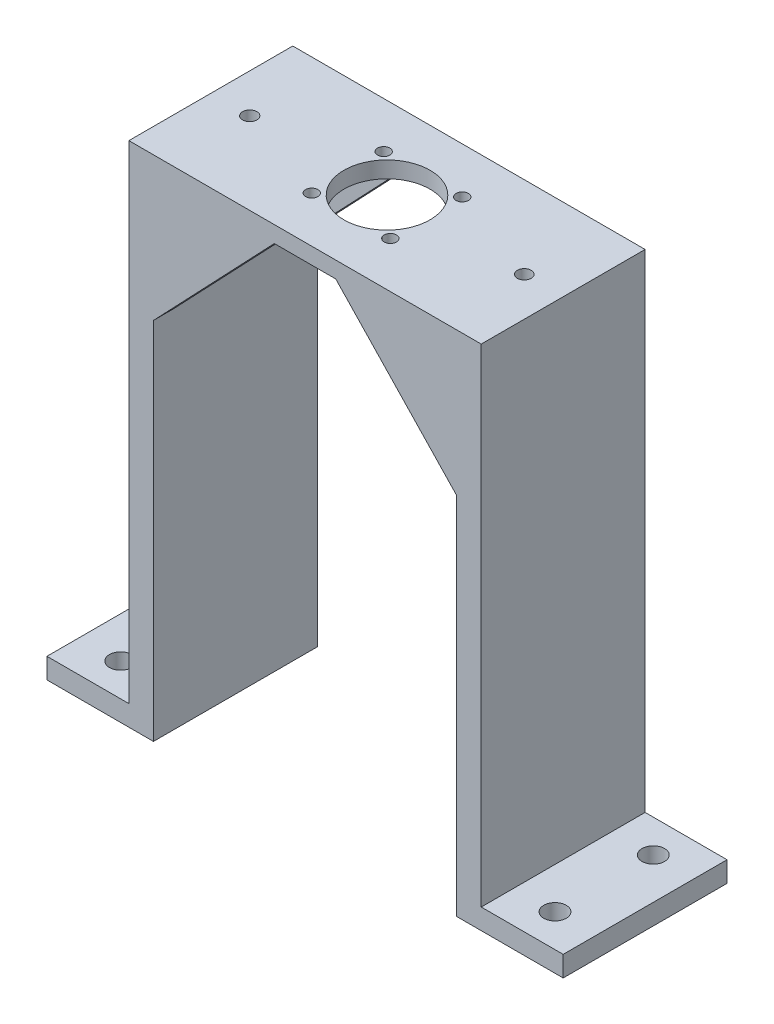
from build123d import *

# Parameters (mm, degrees)
ESQUISSE1_W              = 86
ESQUISSE1_H              = 40
BOSS_EXTRU_1_DEPTH       = 4
ESQUISSE2_R              = 10.5
ENL_V_MAT_EXTRU_1_DEPTH  = 95.93155429
ESQUISSE3_W              = 6
ESQUISSE3_H              = 40
BOSS_EXTRU_2_DEPTH       = 120
ESQUISSE4_W              = 40
ESQUISSE4_H              = 5
BOSS_EXTRU_3_DEPTH       = 20
ESQUISSE5_W              = 40
ESQUISSE5_H              = 5
BOSS_EXTRU_4_DEPTH       = 20
D_GAGEMENT_M51_D         = 5.5
ESQUISSE32_W             = 40
ESQUISSE32_H             = 31
BOSS_EXTRU_5_DEPTH       = 29.5
ESQUISSE33_W             = 40
ESQUISSE33_H             = 31
BOSS_EXTRU_6_DEPTH       = 29.5
ESQUISSE39_R             = 1.5
ENL_V_MAT_EXTRU_4_DEPTH  = 168.964281917
ESQUISSE43_W             = 30
ESQUISSE43_H             = 31
ENL_V_MAT_EXTRU_12_DEPTH = 29.5
ESQUISSE44_W             = 30
ESQUISSE44_H             = 31
ENL_V_MAT_EXTRU_13_DEPTH = 29.5
ENL_V_MAT_EXTRU_14_DEPTH = 166.033329967
ESQUISSE47_R             = 1.75
ESQUISSE47_R_2           = 1.7
ENL_V_MAT_EXTRU_15_DEPTH = 168.964281917


with BuildPart() as part:
    # Esquisse1 → Boss.-Extru.1 (new body)
    with BuildSketch(Plane(origin=(0, 0, 0), x_dir=(1, 0, 0), z_dir=(0, 1, 0))):
        with Locations((43, 20)):
            Rectangle(ESQUISSE1_W, ESQUISSE1_H)
    extrude(amount=BOSS_EXTRU_1_DEPTH)

    # Esquisse2 → Enlèv. mat.-Extru.1 (cut, through all)
    with BuildSketch(Plane(origin=(0, 4, 0), x_dir=(1, 0, 0), z_dir=(0, 1, 0))):
        with Locations(Location((43, 20, 0), (0, 0, 270))):
            Circle(ESQUISSE2_R)
    extrude(amount=-ENL_V_MAT_EXTRU_1_DEPTH, mode=Mode.SUBTRACT)

    # Esquisse3 → Boss.-Extru.2 (add)
    with BuildSketch(Plane(origin=(0, 0, 0), x_dir=(-1, 0, 0), z_dir=(0, -1, 0))):
        with Locations((-3, 20)):
            Rectangle(ESQUISSE3_W, ESQUISSE3_H)
        with Locations((-83, 20)):
            Rectangle(ESQUISSE3_W, ESQUISSE3_H)
    extrude(amount=BOSS_EXTRU_2_DEPTH)

    # Esquisse4 → Boss.-Extru.3 (add)
    with BuildSketch(Plane.ZY):
        with Locations((-20, -117.5)):
            Rectangle(ESQUISSE4_W, ESQUISSE4_H)
    extrude(amount=BOSS_EXTRU_3_DEPTH)

    # Esquisse5 → Boss.-Extru.4 (add)
    with BuildSketch(Plane(origin=(86, 0, 0), x_dir=(0, 0, -1), z_dir=(1, 0, 0))):
        with Locations((20, -117.5)):
            Rectangle(ESQUISSE5_W, ESQUISSE5_H)
    extrude(amount=BOSS_EXTRU_4_DEPTH)

    # Dégagement M51 (through all)
    with Locations(Plane(origin=(0, -115, 0), x_dir=(1, 0, 0), z_dir=(0, 1, 0))):
        with Locations((-10, 32), (-10, 8), (96, 32), (96, 8)):
            Hole(D_GAGEMENT_M51_D / 2)

    # Esquisse32 → Boss.-Extru.5 (add)
    with BuildSketch(Plane(origin=(6, 0, 0), x_dir=(0, 0, -1), z_dir=(1, 0, 0))):
        with Locations((20, -15.5)):
            Rectangle(ESQUISSE32_W, ESQUISSE32_H)
    extrude(amount=BOSS_EXTRU_5_DEPTH)

    # Esquisse33 → Boss.-Extru.6 (add)
    with BuildSketch(Plane.ZY.offset(-80)):
        with Locations((-20, -15.5)):
            Rectangle(ESQUISSE33_W, ESQUISSE33_H)
    extrude(amount=BOSS_EXTRU_6_DEPTH)

    # Esquisse39 → Enlèv. mat.-Extru.4 (cut, through all)
    with BuildSketch(Plane(origin=(0, 4, 0), x_dir=(1, 0, 0), z_dir=(0, 1, 0))):
        with Locations(Location((33.410152006, 28.776947958, 0), (0, 0, 270))):
            Circle(ESQUISSE39_R)
        with Locations(Location((33.410152006, 11.223052042, 0), (0, 0, 270))):
            Circle(ESQUISSE39_R)
        with Locations(Location((52.589847994, 11.223052042, 0), (0, 0, 270))):
            Circle(ESQUISSE39_R)
        with Locations(Location((52.589847994, 28.776947958, 0), (0, 0, 270))):
            Circle(ESQUISSE39_R)
    extrude(amount=-ENL_V_MAT_EXTRU_4_DEPTH, mode=Mode.SUBTRACT)

    # Esquisse43 → Enlèv. mat.-Extru.12 (cut)
    with BuildSketch(Plane(origin=(35.5, 0, 0), x_dir=(0, 0, -1), z_dir=(1, 0, 0))):
        with Locations((20, -15.5)):
            Rectangle(ESQUISSE43_W, ESQUISSE43_H)
    extrude(amount=-ENL_V_MAT_EXTRU_12_DEPTH, mode=Mode.SUBTRACT)

    # Esquisse44 → Enlèv. mat.-Extru.13 (cut)
    with BuildSketch(Plane.ZY.offset(-50.5)):
        with Locations((-20, -15.5)):
            Rectangle(ESQUISSE44_W, ESQUISSE44_H)
    extrude(amount=-ENL_V_MAT_EXTRU_13_DEPTH, mode=Mode.SUBTRACT)

    # Esquisse34 → Enlèv. mat.-Extru.14 (cut, through all)
    with BuildSketch(Plane.XY):
        Polygon((6, -31), (35.5, 0), (35.5, -31), align=None)
        Polygon((50.5, 0), (80, -31), (50.5, -31), align=None)
    extrude(amount=-ENL_V_MAT_EXTRU_14_DEPTH, mode=Mode.SUBTRACT)

    # Esquisse47 → Enlèv. mat.-Extru.15 (cut, through all)
    with BuildSketch(Plane(origin=(0, 4, 0), x_dir=(1, 0, 0), z_dir=(0, 1, 0))):
        with Locations(Location((9.5, 20, 0), (0, 0, 270))):
            Circle(ESQUISSE47_R)
        with Locations(Location((76.5, 20, 0), (0, 0, 270))):
            Circle(ESQUISSE47_R_2)
    extrude(amount=-ENL_V_MAT_EXTRU_15_DEPTH, mode=Mode.SUBTRACT)


solid = part.part
